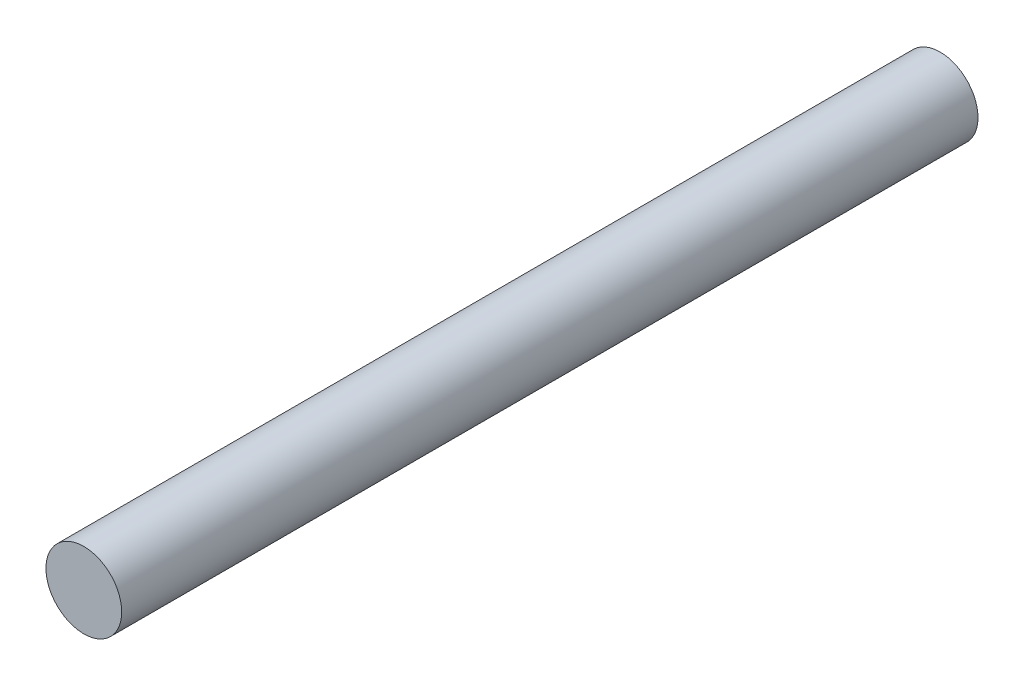
from build123d import *

# Parameters (mm, degrees)
SKETCH_1_R      = 5
EXTRUDE_1_DEPTH = 113


with BuildPart() as part:
    # ｽｹｯﾁ1 → ﾎﾞｽ - 押し出し1 (new body)
    with BuildSketch(Plane.XY):
        Circle(SKETCH_1_R)
    extrude(amount=EXTRUDE_1_DEPTH)


solid = part.part
